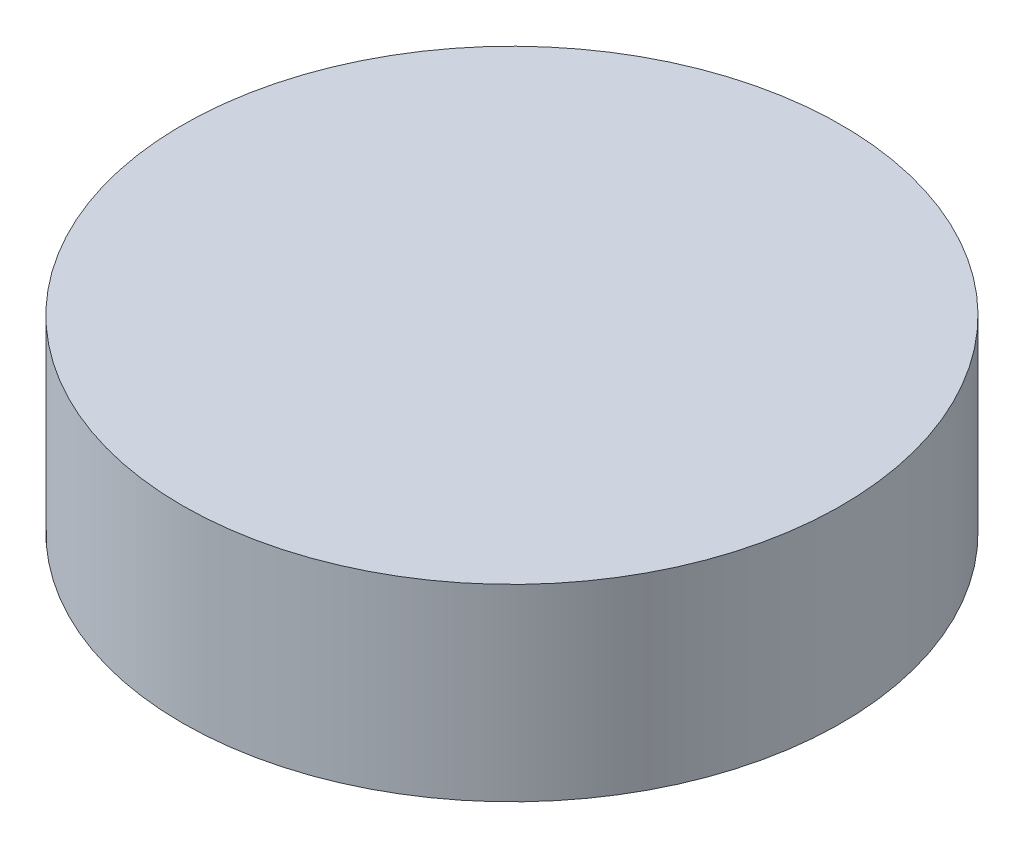
from build123d import *

# Parameters (mm, degrees)
SKETCH1_R           = 35
BOSS_EXTRUDE1_DEPTH = 20


with BuildPart() as part:
    # Sketch1 → Boss-Extrude1 (new body)
    with BuildSketch(Plane(origin=(0, 0, 0), x_dir=(1, 0, 0), z_dir=(0, 1, 0))):
        with Locations(Location((0, 0, 0), (0, 0, 270))):
            Circle(SKETCH1_R)
    extrude(amount=BOSS_EXTRUDE1_DEPTH)


solid = part.part
